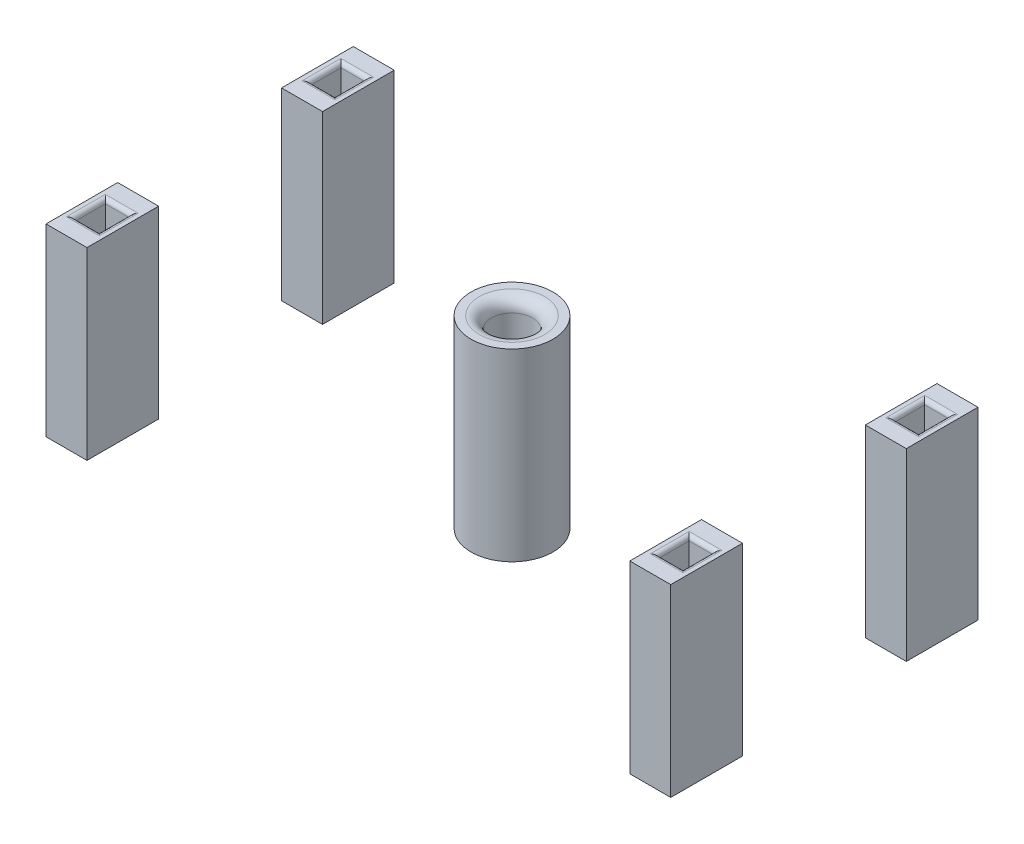
from build123d import *

# Parameters (mm, degrees)
SKETCH1_R             = 10
SKETCH1_R_2           = 5
BOSS_EXTRUDE1_DEPTH   = 45
SKETCH1_W             = 10
SKETCH1_H             = 17.5
SKETCH1_W_2           = 6
SKETCH1_H_2           = 7.5
BOSS_EXTRUDE1_2_DEPTH = 45
BOSS_EXTRUDE1_3_DEPTH = 45
BOSS_EXTRUDE1_4_DEPTH = 45
BOSS_EXTRUDE1_5_DEPTH = 45
FILLET1_R             = 1
FILLET2_R             = 1
FILLET3_R             = 1
FILLET4_R             = 1
FILLET5_R             = 3


with BuildPart() as part:
    # Sketch1 → Boss-Extrude1 (new body)
    with BuildSketch(Plane(origin=(0, 0, 0), x_dir=(1, 0, 0), z_dir=(0, 1, 0))):
        with Locations(Location((0, 0, 0), (0, 0, 90))):
            Circle(SKETCH1_R)
        with Locations(Location((0, 0, 0), (0, 0, 90))):
            Circle(SKETCH1_R_2, mode=Mode.SUBTRACT)
    extrude(amount=BOSS_EXTRUDE1_DEPTH)

    # Fillet5
    fillet5_edges = [part.edges().sort_by_distance(p)[0] for p in [
        (0, 0, 5),
        (0, 45, 5),
    ]]
    fillet(fillet5_edges, radius=FILLET5_R)


with BuildPart() as body_2:
    # Sketch1 → Boss-Extrude1 2 (new body)
    with BuildSketch(Plane(origin=(0, 0, 0), x_dir=(1, 0, 0), z_dir=(0, 1, 0))):
        with Locations((-71.25, -28.75)):
            Rectangle(SKETCH1_W, SKETCH1_H)
        with Locations((-71.25, -28.75)):
            Rectangle(SKETCH1_W_2, SKETCH1_H_2, mode=Mode.SUBTRACT)
    extrude(amount=BOSS_EXTRUDE1_2_DEPTH)

    # Fillet2
    fillet2_edges = [body_2.edges().sort_by_distance(p)[0] for p in [
        (-68.25, 0, 28.75),
        (-71.25, 0, 25),
        (-74.25, 0, 28.75),
        (-71.25, 0, 32.5),
        (-71.25, 45, 32.5),
        (-74.25, 45, 28.75),
        (-71.25, 45, 25),
        (-68.25, 45, 28.75),
    ]]
    fillet(fillet2_edges, radius=FILLET2_R)


with BuildPart() as body_3:
    # Sketch1 → Boss-Extrude1 3 (new body)
    with BuildSketch(Plane(origin=(0, 0, 0), x_dir=(1, 0, 0), z_dir=(0, 1, 0))):
        with Locations((-71.25, 28.75)):
            Rectangle(SKETCH1_W, SKETCH1_H)
        with Locations((-71.25, 28.75)):
            Rectangle(SKETCH1_W_2, SKETCH1_H_2, mode=Mode.SUBTRACT)
    extrude(amount=BOSS_EXTRUDE1_3_DEPTH)

    # Fillet1
    fillet1_edges = [body_3.edges().sort_by_distance(p)[0] for p in [
        (-74.25, 0, -28.75),
        (-71.25, 0, -25),
        (-68.25, 0, -28.75),
        (-71.25, 0, -32.5),
        (-71.25, 45, -32.5),
        (-68.25, 45, -28.75),
        (-71.25, 45, -25),
        (-74.25, 45, -28.75),
    ]]
    fillet(fillet1_edges, radius=FILLET1_R)


with BuildPart() as body_4:
    # Sketch1 → Boss-Extrude1 4 (new body)
    with BuildSketch(Plane(origin=(0, 0, 0), x_dir=(1, 0, 0), z_dir=(0, 1, 0))):
        with Locations((71.25, 28.75)):
            Rectangle(SKETCH1_W, SKETCH1_H)
        with Locations((71.25, 28.75)):
            Rectangle(SKETCH1_W_2, SKETCH1_H_2, mode=Mode.SUBTRACT)
    extrude(amount=BOSS_EXTRUDE1_4_DEPTH)

    # Fillet4
    fillet4_edges = [body_4.edges().sort_by_distance(p)[0] for p in [
        (68.25, 0, -28.75),
        (71.25, 0, -25),
        (74.25, 0, -28.75),
        (71.25, 0, -32.5),
        (71.25, 45, -32.5),
        (74.25, 45, -28.75),
        (71.25, 45, -25),
        (68.25, 45, -28.75),
    ]]
    fillet(fillet4_edges, radius=FILLET4_R)


with BuildPart() as body_5:
    # Sketch1 → Boss-Extrude1 5 (new body)
    with BuildSketch(Plane(origin=(0, 0, 0), x_dir=(1, 0, 0), z_dir=(0, 1, 0))):
        with Locations((71.25, -28.75)):
            Rectangle(SKETCH1_W, SKETCH1_H)
        with Locations((71.25, -28.75)):
            Rectangle(SKETCH1_W_2, SKETCH1_H_2, mode=Mode.SUBTRACT)
    extrude(amount=BOSS_EXTRUDE1_5_DEPTH)

    # Fillet3
    fillet3_edges = [body_5.edges().sort_by_distance(p)[0] for p in [
        (68.25, 0, 28.75),
        (71.25, 0, 32.5),
        (74.25, 0, 28.75),
        (71.25, 0, 25),
        (71.25, 45, 25),
        (74.25, 45, 28.75),
        (71.25, 45, 32.5),
        (68.25, 45, 28.75),
    ]]
    fillet(fillet3_edges, radius=FILLET3_R)


solid = Compound([part.part, body_2.part, body_3.part, body_4.part, body_5.part])
